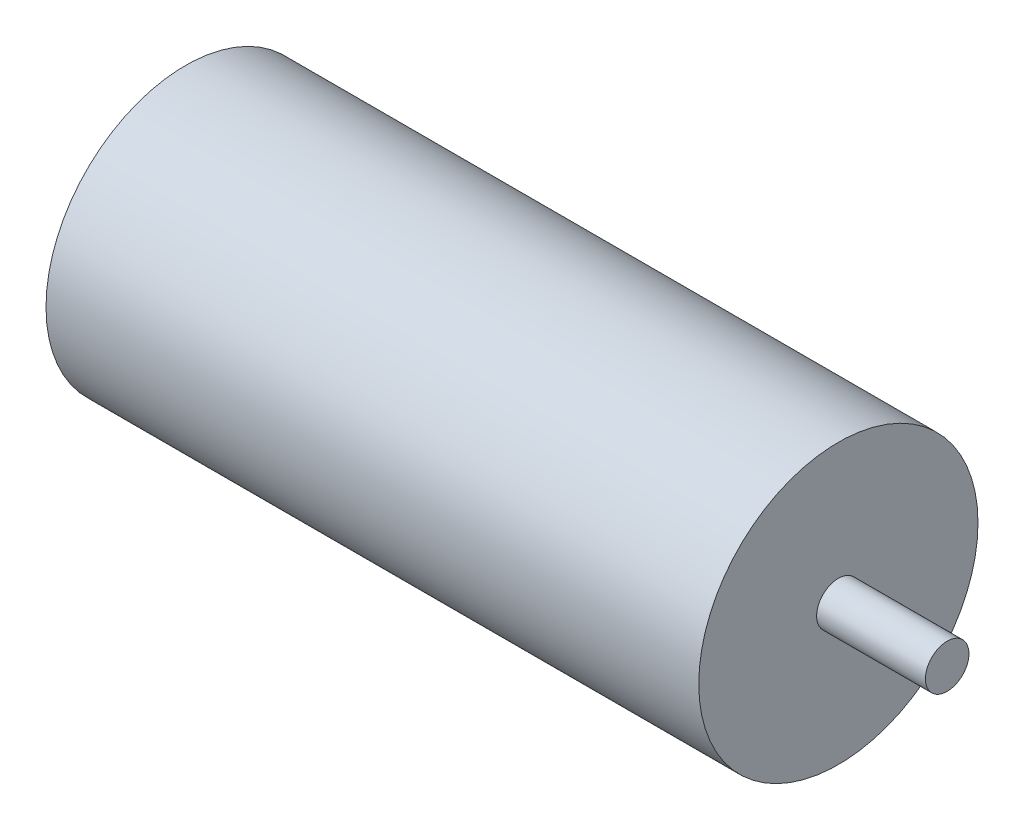
from build123d import *

# Parameters (mm, degrees)
SKETCH1_R                = 38.5
SKETCH1_R_2              = 6
BOSS_EXTRUDE1_DEPTH      = 180
BOSS_EXTRUDE2_DEPTH      = 210
BOSS_EXTRUDE2_DEPTH_BACK = 15
SKETCH1_3_R              = 6


with BuildPart() as part:
    # Sketch1 → Boss-Extrude1 (new body)
    with BuildSketch(Plane(origin=(0, 0, 0), x_dir=(0, 0, -1), z_dir=(1, 0, 0))):
        Circle(SKETCH1_R)
        Circle(SKETCH1_R_2, mode=Mode.SUBTRACT)
    extrude(amount=BOSS_EXTRUDE1_DEPTH)

    # Sketch1<3> → Boss-Extrude2 (add, two sides: drawn at the far end of the back side and taken through both)
    with BuildSketch(Plane(origin=(0, 0, 0), x_dir=(0, 0, -1), z_dir=(1, 0, 0)).offset(-BOSS_EXTRUDE2_DEPTH_BACK)):
        Circle(SKETCH1_3_R)
    extrude(amount=BOSS_EXTRUDE2_DEPTH + BOSS_EXTRUDE2_DEPTH_BACK)


solid = part.part
